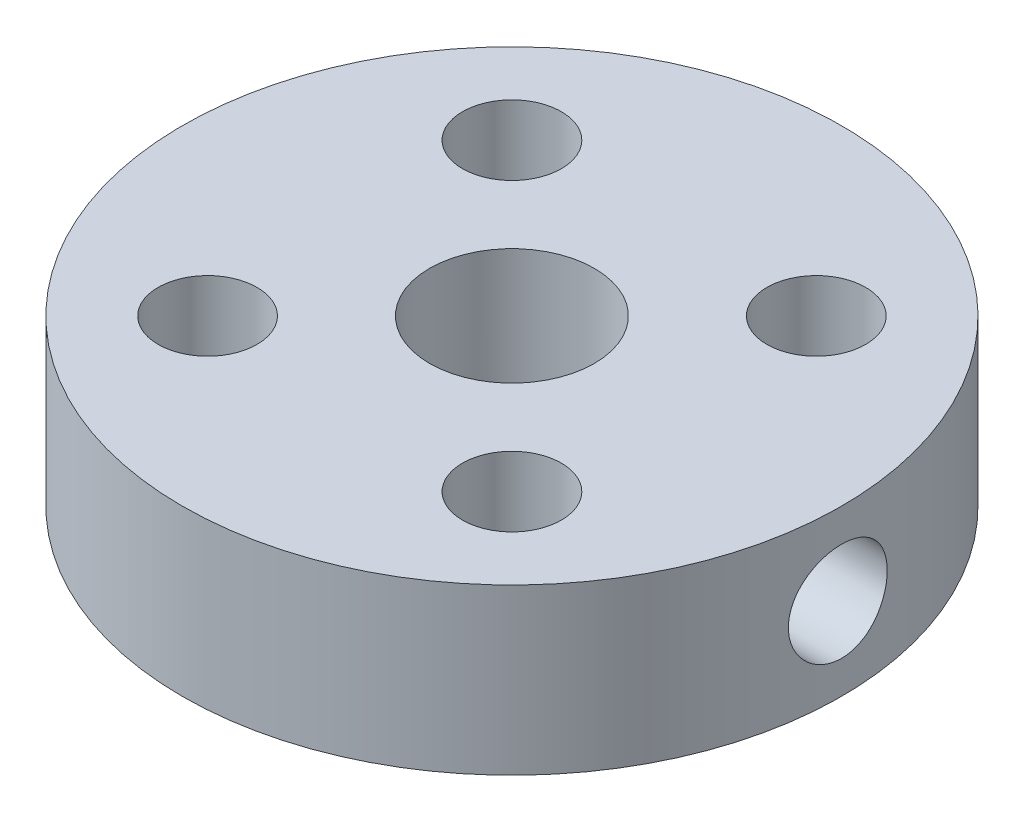
from build123d import *

# Parameters (mm, degrees)
SKETCH_1_R          = 1.5
EXTRUDE_1_DEPTH     = 5
SKETCH_2_R          = 1.5
CUT_EXTRUDE_4_DEPTH = 9
SKETCH1_R           = 2.5
CUT_EXTRUDE1_DEPTH  = 10


with BuildPart() as part:
    # Эскиз1 → Бобышка-Вытянуть1 (new body)
    # profile 1 of 2: a face of its own
    with BuildSketch(Plane(origin=(0, 0, 0), x_dir=(1, 0, 0), z_dir=(0, 1, 0))):
        with BuildLine():
            Line((0, 10), (0, 2))
            ThreePointArc((0, 2), (0.765366865, 1.847759065), (1.414213562, 1.414213562))
            Line((1.414213562, 1.414213562), (3.556747109, 3.556747109))
            ThreePointArc((3.556747109, 3.556747109), (3.556747109, 5.678067453), (5.678067453, 5.678067453))
            Line((5.678067453, 5.678067453), (7.071067812, 7.071067812))
            ThreePointArc((7.071067812, 7.071067812), (3.826834324, 9.238795325), (0, 10))
        make_face()
    # profile 2 of 2: a face of its own
    with BuildSketch(Plane(origin=(0, 0, 0), x_dir=(1, 0, 0), z_dir=(0, 1, 0))):
        with BuildLine():
            ThreePointArc((2, 0), (-1.414213562, -1.414213562), (0, 2))
            Line((0, 2), (0, 10))
            ThreePointArc((0, 10), (-7.071067812, -7.071067812), (10, 0))
            ThreePointArc((10, 0), (9.238795325, 3.826834324), (7.071067812, 7.071067812))
            Line((7.071067812, 7.071067812), (5.678067453, 5.678067453))
            ThreePointArc((5.678067453, 5.678067453), (6.00322658, 5.19143243), (6.117407281, 4.617407281))
            ThreePointArc((6.117407281, 4.617407281), (5.19143243, 3.231587982), (3.556747109, 3.556747109))
            Line((3.556747109, 3.556747109), (1.414213562, 1.414213562))
            ThreePointArc((1.414213562, 1.414213562), (1.847759065, 0.765366865), (2, 0))
        make_face()
        with Locations(Location((-4.617407281, -4.617407281, 0), (0, 0, 270))):
            Circle(SKETCH_1_R, mode=Mode.SUBTRACT)
        with Locations(Location((4.617407281, -4.617407281, 0), (0, 0, 270))):
            Circle(SKETCH_1_R, mode=Mode.SUBTRACT)
        with Locations(Location((-4.617407281, 4.617407281, 0), (0, 0, 270))):
            Circle(SKETCH_1_R, mode=Mode.SUBTRACT)
    extrude(amount=EXTRUDE_1_DEPTH)

    # Эскиз2 → Вырез-Вытянуть4 (cut)
    with BuildSketch(Plane(origin=(10, 0, 0), x_dir=(0, 0, -1), z_dir=(1, 0, 0))):
        with Locations((0, 2.5)):
            Circle(SKETCH_2_R)
    extrude(amount=-CUT_EXTRUDE_4_DEPTH, mode=Mode.SUBTRACT)

    # Sketch1 → Cut-Extrude1 (cut)
    with BuildSketch(Plane.XZ):
        with Locations(Location((0, 0, 0), (0, 0, 270))):
            Circle(SKETCH1_R)
    extrude(amount=-CUT_EXTRUDE1_DEPTH, mode=Mode.SUBTRACT)


solid = part.part
